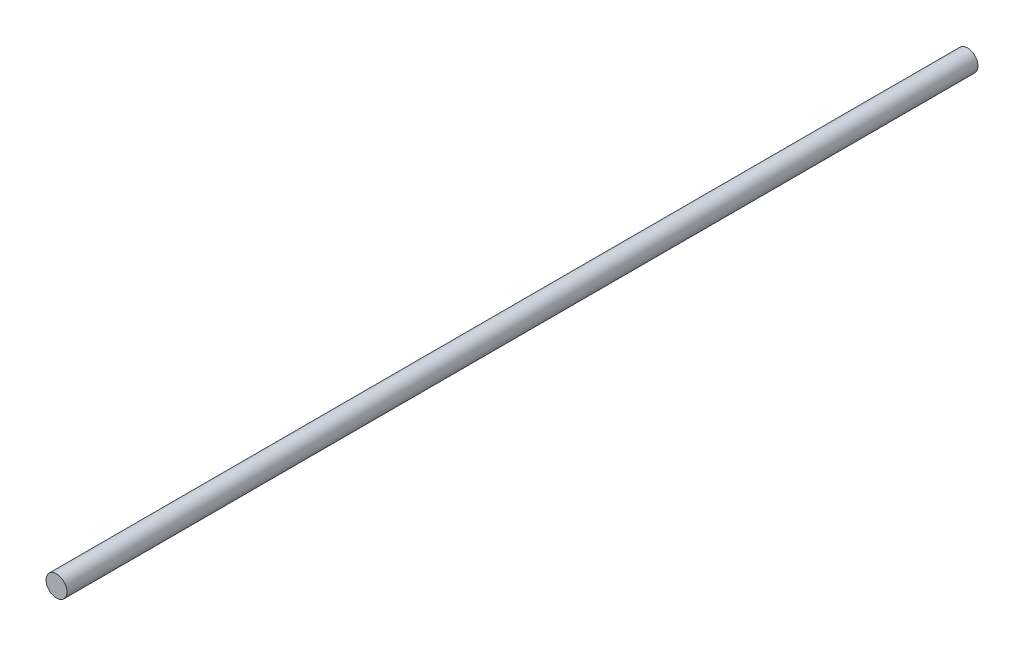
from build123d import *

# Parameters (mm, degrees)
SZKIC1_R                    = 3
DODANIE_WYCI_GNI_CIE1_DEPTH = 260


with BuildPart() as part:
    # Szkic1 → Dodanie-wyciągnięcie1 (new body)
    with BuildSketch(Plane.XY):
        Circle(SZKIC1_R)
    extrude(amount=DODANIE_WYCI_GNI_CIE1_DEPTH)


solid = part.part
